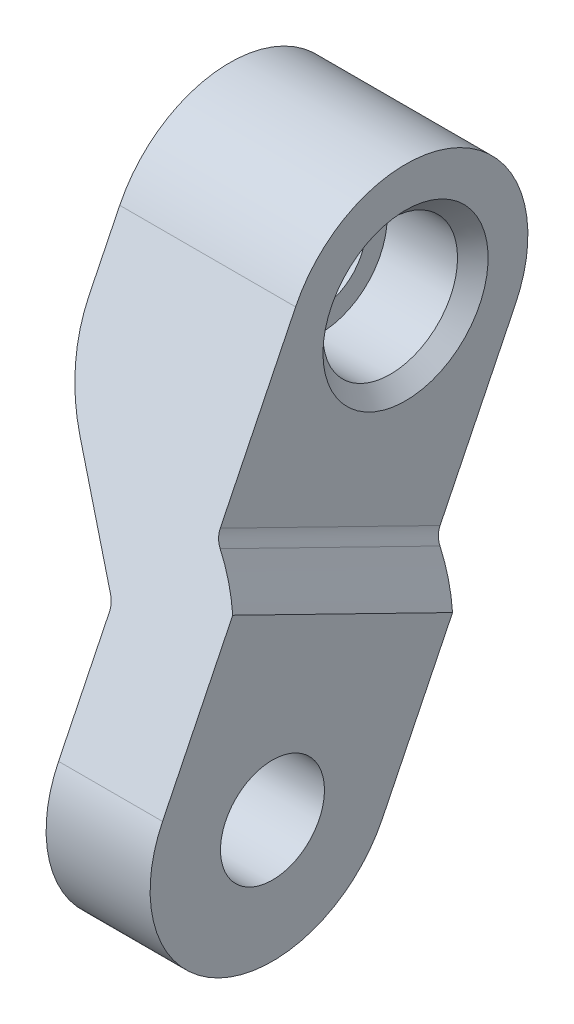
from build123d import *

# Parameters (mm, degrees)
BOSS_EXTRUDE1_DEPTH = 6.9
CUT_EXTRUDE1_DEPTH  = 41.174882094
CUT_EXTRUDE2_DEPTH  = 41.174882094
HOLE1_D             = 3.4
HOLE2_D             = 3
HOLE2_CBORE_D       = 4.4
HOLE2_CBORE_DEPTH   = 2.8
FILLET1_R           = 0.6
FILLET2_R           = 5
CHAMFER2_SIZE       = 0.5


with BuildPart() as part:
    # Sketch1 → Boss-Extrude1 (new body)
    with BuildSketch(Plane(origin=(-30.446370889, 0, 0), x_dir=(0, 0, -1), z_dir=(1, 0, 0))):
        with BuildLine():
            Line((93.90701583, -40.982811072), (88.40701583, -52.223840783))
            ThreePointArc((88.40701583, -52.223840783), (90.242028227, -57.574796726), (95.59298417, -55.739784329))
            Line((95.59298417, -55.739784329), (101.09298417, -44.498754618))
            ThreePointArc((101.09298417, -44.498754618), (99.257971773, -39.147798675), (93.90701583, -40.982811072))
        make_face()
    extrude(amount=-BOSS_EXTRUDE1_DEPTH)

    # Sketch2 → Cut-Extrude1 (cut, through all)
    with BuildSketch(Plane(origin=(0, -48.50387467, -99.133362956), x_dir=(-1, 0, 0), z_dir=(0, -0.43949294330941685, -0.8982460424523036))):
        Polygon((37.346370889, 0.458822931), (33.846370889, -4.055598708), (33.846370889, -14.237691346), (37.346370889, -14.237691346), align=None)
    extrude(amount=-CUT_EXTRUDE1_DEPTH, mode=Mode.SUBTRACT)

    # Sketch3 → Cut-Extrude2 (cut, through all)
    with BuildSketch(Plane(origin=(0, -48.50387467, -99.133362956), x_dir=(-1, 0, 0), z_dir=(0, -0.4394929433094169, -0.8982460424523037))):
        with BuildLine():
            Line((29.844897196, 8.580951501), (29.844897196, -5.213665722))
            ThreePointArc((29.844897196, -5.213665722), (30.303827303, -3.12113514), (31.596370889, -1.412734673))
            Line((31.596370889, -1.412734673), (31.596370889, 8.580951501))
            Line((31.596370889, 8.580951501), (29.844897196, 8.580951501))
        make_face()
    extrude(amount=-CUT_EXTRUDE2_DEPTH, mode=Mode.SUBTRACT)

    # Hole1 (through all)
    with Locations(Plane(origin=(-30.446370889, 0, 0), x_dir=(0, 0, -1), z_dir=(1, 0, 0))):
        with Locations((92, -53.981812556)):
            Hole(HOLE1_D / 2)

    # Hole2 (through all)
    with Locations(Plane(origin=(-31.596370889, 0, 0), x_dir=(0, 0, -1), z_dir=(1, 0, 0))):
        with Locations((97.5, -42.740782845)):
            CounterBoreHole(HOLE2_D / 2, HOLE2_CBORE_D / 2, HOLE2_CBORE_DEPTH)

    # Fillet1
    fillet1_edges = [part.edges().sort_by_distance(p)[0] for p in [
        (-33.846370889, -50.388828386, -93.757971773),
        (-31.596370889, -48.014886226, -94.919491867),
    ]]
    fillet(fillet1_edges, radius=FILLET1_R)

    # Fillet2
    fillet2_edges = [part.edges().sort_by_distance(p)[0] for p in [
        (-37.346370889, -46.333767015, -95.742028227),
    ]]
    fillet(fillet2_edges, radius=FILLET2_R)

    # Chamfer2
    chamfer2_edges = [part.edges().sort_by_distance(p)[0] for p in [
        (-31.596370889, -42.740782845, -95.3),
    ]]
    chamfer(chamfer2_edges, length=CHAMFER2_SIZE)


solid = part.part
